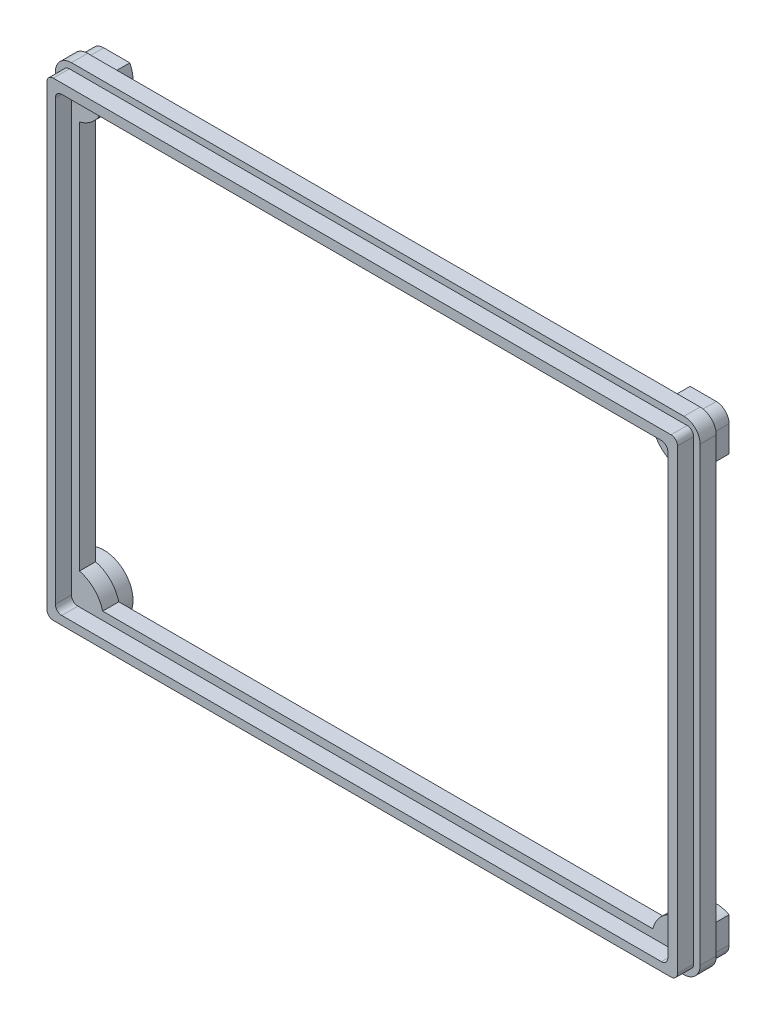
from build123d import *

# Parameters (mm, degrees)
RESSALTO_EXTRUS_O1_DEPTH   = 10
RESSALTO_EXTRUS_O1_2_DEPTH = 10
RESSALTO_EXTRUS_O1_3_DEPTH = 10
RESSALTO_EXTRUS_O1_4_DEPTH = 10
RESSALTO_EXTRUS_O2_DEPTH   = 5
RESSALTO_EXTRUS_O2_2_DEPTH = 5
RESSALTO_EXTRUS_O2_3_DEPTH = 5
RESSALTO_EXTRUS_O2_4_DEPTH = 5
ESBO_O6_W                  = 8.660254038
ESBO_O6_H                  = 1
ESBO_O6_W_2                = 1
ESBO_O6_H_2                = 8.660254038
ESBO_O6_H_3                = 8.655255985
CORTE_EXTRUS_O2_DEPTH      = 5
CORTE_EXTRUS_O10_START     = -5
CORTE_EXTRUS_O10_DEPTH     = 5
CORTE_EXTRUS_O11_DEPTH     = 5
CORTE_EXTRUS_O12_START     = -5
CORTE_EXTRUS_O12_DEPTH     = 5
CORTE_EXTRUS_O15_DEPTH     = 5
CORTE_EXTRUS_O23_DEPTH     = 5
CORTE_EXTRUS_O24_DEPTH     = 5
ESBO_O15_W                 = 195.604606203
ESBO_O15_H                 = 145.68333658
RESSALTO_EXTRUS_O3_DEPTH   = 5
ESBO_O16_W                 = 190
ESBO_O16_H                 = 140
CORTE_EXTRUS_O25_DEPTH     = 5
FILETE1_R                  = 2
FILETE2_R                  = 2
FILETE3_R                  = 2
FILETE4_R                  = 2
FILETE5_R                  = 2
FILETE6_R                  = 2
FILETE7_R                  = 2
FILETE8_R                  = 2


with BuildPart() as part:
    # Esboço4 → Ressalto-extrusão1 (new body)
    with BuildSketch(Plane.XY):
        with BuildLine():
            Line((-94.587795422, 19.928649923), (-94.587795422, 28.588903961))
            ThreePointArc((-94.587795422, 28.588903961), (-93.123329328, 32.124437867), (-89.587795422, 33.588903961))
            Line((-89.587795422, 33.588903961), (-80.927541384, 33.588903961))
            ThreePointArc((-80.927541384, 33.588903961), (-82.51672761, 21.517836149), (-94.587795422, 19.928649923))
        make_face()
    extrude(amount=-RESSALTO_EXTRUS_O1_DEPTH)


with BuildPart() as body_2:
    # Esboço4 → Ressalto-extrus_o1 2 (new body)
    with BuildSketch(Plane.XY):
        with BuildLine():
            Line((91.75195054, 33.588903961), (100.412204578, 33.588903961))
            ThreePointArc((100.412204578, 33.588903961), (103.947738484, 32.124437867), (105.412204578, 28.588903961))
            Line((105.412204578, 28.588903961), (105.412204578, 19.928649923))
            ThreePointArc((105.412204578, 19.928649923), (93.341136766, 21.517836149), (91.75195054, 33.588903961))
        make_face()
    extrude(amount=-RESSALTO_EXTRUS_O1_2_DEPTH)


with BuildPart() as body_3:
    # Esboço4 → Ressalto-extrus_o1 3 (new body)
    with BuildSketch(Plane.XY):
        with BuildLine():
            Line((105.412204578, -102.750842001), (105.412204578, -111.411096039))
            ThreePointArc((105.412204578, -111.411096039), (103.947738484, -114.946629945), (100.412204578, -116.411096039))
            Line((100.412204578, -116.411096039), (91.75195054, -116.411096039))
            ThreePointArc((91.75195054, -116.411096039), (93.341136766, -104.340028227), (105.412204578, -102.750842001))
        make_face()
    extrude(amount=-RESSALTO_EXTRUS_O1_3_DEPTH)


with BuildPart() as body_4:
    # Esboço4 → Ressalto-extrus_o1 4 (new body)
    with BuildSketch(Plane.XY):
        with BuildLine():
            Line((-80.927541384, -116.411096039), (-89.587795422, -116.411096039))
            ThreePointArc((-89.587795422, -116.411096039), (-93.123329328, -114.946629945), (-94.587795422, -111.411096039))
            Line((-94.587795422, -111.411096039), (-94.587795422, -102.750842001))
            ThreePointArc((-94.587795422, -102.750842001), (-82.51672761, -104.340028227), (-80.927541384, -116.411096039))
        make_face()
    extrude(amount=-RESSALTO_EXTRUS_O1_4_DEPTH)


with BuildPart() as body_5:
    # Esboço5 → Ressalto-extrusão2 (new body)
    with BuildSketch(Plane.XY):
        with BuildLine():
            Line((-87.087795422, 18.906445595), (-87.087795422, -101.728637674))
            ThreePointArc((-87.087795422, -101.728637674), (-90.938249206, -101.502701892), (-94.587795422, -102.750842001))
            Line((-94.587795422, -102.750842001), (-94.587795422, 19.928649923))
            ThreePointArc((-94.587795422, 19.928649923), (-90.938249206, 18.680509814), (-87.087795422, 18.906445595))
        make_face()
    extrude(amount=-RESSALTO_EXTRUS_O2_DEPTH)


with BuildPart() as body_6:
    # Esboço5 → Ressalto-extrus_o2 2 (new body)
    with BuildSketch(Plane.XY):
        with BuildLine():
            Line((-80.927541384, -116.411096039), (91.75195054, -116.411096039))
            ThreePointArc((91.75195054, -116.411096039), (90.50381043, -112.761549823), (90.729746212, -108.911096039))
            Line((90.729746212, -108.911096039), (-79.905337057, -108.911096039))
            ThreePointArc((-79.905337057, -108.911096039), (-79.679401275, -112.761549823), (-80.927541384, -116.411096039))
        make_face()
    extrude(amount=-RESSALTO_EXTRUS_O2_2_DEPTH)


with BuildPart() as body_7:
    # Esboço5 → Ressalto-extrus_o2 3 (new body)
    with BuildSketch(Plane.XY):
        with BuildLine():
            Line((97.912204578, 18.906445595), (97.912204578, -101.728637674))
            ThreePointArc((97.912204578, -101.728637674), (101.762658361, -101.502701892), (105.412204578, -102.750842001))
            Line((105.412204578, -102.750842001), (105.412204578, 19.928649923))
            ThreePointArc((105.412204578, 19.928649923), (101.762658361, 18.680509814), (97.912204578, 18.906445595))
        make_face()
    extrude(amount=-RESSALTO_EXTRUS_O2_3_DEPTH)


with BuildPart() as body_8:
    # Esboço5 → Ressalto-extrus_o2 4 (new body)
    with BuildSketch(Plane.XY):
        with BuildLine():
            Line((90.729746212, 26.088903961), (-79.905337057, 26.088903961))
            ThreePointArc((-79.905337057, 26.088903961), (-79.679401275, 29.939357745), (-80.927541384, 33.588903961))
            Line((-80.927541384, 33.588903961), (91.75195054, 33.588903961))
            ThreePointArc((91.75195054, 33.588903961), (90.50381043, 29.939357745), (90.729746212, 26.088903961))
        make_face()
    extrude(amount=-RESSALTO_EXTRUS_O2_4_DEPTH)


with BuildPart() as corte_extrus_o2_tool:
    # Esboço6 → Corte-extrusão2 (new body)
    with BuildSketch(Plane(origin=(0, 0, -10), x_dir=(-1, 0, 0), z_dir=(0, 0, -1))):
        with Locations((-96.082077559, 33.088903961)):
            Rectangle(ESBO_O6_W, ESBO_O6_H)
        with Locations((-104.912204578, 24.258776942)):
            Rectangle(ESBO_O6_W_2, ESBO_O6_H_2)
        with Locations((85.257668403, 33.088903961)):
            Rectangle(ESBO_O6_W, ESBO_O6_H)
        with Locations((94.087795422, 24.258776942)):
            Rectangle(ESBO_O6_W_2, ESBO_O6_H_2)
        with Locations((94.087795422, -107.078469994)):
            Rectangle(ESBO_O6_W_2, ESBO_O6_H_3)
        with Locations((85.257668403, -115.911096039)):
            Rectangle(ESBO_O6_W, ESBO_O6_H)
        with Locations((-96.082077559, -115.911096039)):
            Rectangle(ESBO_O6_W, ESBO_O6_H)
        with Locations((-104.912204578, -107.078469994)):
            Rectangle(ESBO_O6_W_2, ESBO_O6_H_3)
    extrude(amount=-CORTE_EXTRUS_O2_DEPTH)


with BuildPart() as part_1:
    add(part.part)

    # Corte-extrusão2: cut by corte_extrus_o2_tool
    add(corte_extrus_o2_tool.part, mode=Mode.SUBTRACT)


with BuildPart() as body_2_1:
    add(body_2.part)

    # Corte-extrusão2: cut by corte_extrus_o2_tool
    add(corte_extrus_o2_tool.part, mode=Mode.SUBTRACT)


with BuildPart() as body_3_1:
    add(body_3.part)

    # Corte-extrusão2: cut by corte_extrus_o2_tool
    add(corte_extrus_o2_tool.part, mode=Mode.SUBTRACT)


with BuildPart() as body_4_1:
    add(body_4.part)

    # Corte-extrusão2: cut by corte_extrus_o2_tool
    add(corte_extrus_o2_tool.part, mode=Mode.SUBTRACT)


with BuildPart() as corte_extrus_o10_tool:
    # Esboço7 → Corte-extrusão10 (new body)
    with BuildSketch(Plane(origin=(0, 0, -10), x_dir=(-1, 0, 0), z_dir=(0, 0, -1)).offset(CORTE_EXTRUS_O10_START)):
        with BuildLine():
            Line((-104.412204578, 20.478816645), (-104.412204578, 19.928649923))
            Line((-104.412204578, 19.928649923), (-105.412204578, 19.928649923))
            ThreePointArc((-105.412204578, 19.928649923), (-93.341136766, 21.517836149), (-91.75195054, 33.588903961))
            Line((-91.75195054, 33.588903961), (-91.75195054, 32.588903961))
            Line((-91.75195054, 32.588903961), (-92.302117262, 32.588903961))
            ThreePointArc((-92.302117262, 32.588903961), (-93.947771981, 22.124471364), (-104.412204578, 20.478816645))
        make_face()
        with BuildLine():
            Line((80.927541384, 33.588903961), (80.927541384, 32.588903961))
            Line((80.927541384, 32.588903961), (81.478060811, 32.588903961))
            ThreePointArc((81.478060811, 32.588903961), (83.127936997, 22.129045536), (93.587795422, 20.47916935))
            Line((93.587795422, 20.47916935), (93.587795422, 19.928649923))
            Line((93.587795422, 19.928649923), (94.587795422, 19.928649923))
            ThreePointArc((94.587795422, 19.928649923), (82.51672761, 21.517836149), (80.927541384, 33.588903961))
        make_face()
        with BuildLine():
            Line((94.587795422, -102.750842001), (93.587795422, -102.750842001))
            Line((93.587795422, -102.750842001), (93.587795422, -103.300929913))
            ThreePointArc((93.587795422, -103.300929913), (83.122340911, -104.945641528), (81.477629296, -115.411096039))
            Line((81.477629296, -115.411096039), (80.927541384, -115.411096039))
            Line((80.927541384, -115.411096039), (80.927541384, -116.411096039))
            ThreePointArc((80.927541384, -116.411096039), (82.51672761, -104.340028227), (94.587795422, -102.750842001))
        make_face()
        with BuildLine():
            Line((-105.412204578, -102.750842001), (-104.412204578, -102.750842001))
            Line((-104.412204578, -102.750842001), (-104.412204578, -103.300967216))
            ThreePointArc((-104.412204578, -103.300967216), (-93.947233755, -104.946125217), (-92.302075754, -115.411096039))
            Line((-92.302075754, -115.411096039), (-91.75195054, -115.411096039))
            Line((-91.75195054, -115.411096039), (-91.75195054, -116.411096039))
            ThreePointArc((-91.75195054, -116.411096039), (-93.341136766, -104.340028227), (-105.412204578, -102.750842001))
        make_face()
    extrude(amount=CORTE_EXTRUS_O10_DEPTH)


with BuildPart() as part_2:
    add(part_1.part)

    # Corte-extrusão10: cut by corte_extrus_o10_tool
    add(corte_extrus_o10_tool.part, mode=Mode.SUBTRACT)

    # Esboço10 → Corte-extrusão12 (cut)
    with BuildSketch(Plane(origin=(0, 0, -10), x_dir=(-1, 0, 0), z_dir=(0, 0, -1)).offset(CORTE_EXTRUS_O12_START)):
        with BuildLine():
            Line((89.587795422, 33.588903961), (89.587795422, 32.588903961))
            ThreePointArc((89.587795422, 32.588903961), (92.416222547, 31.417331086), (93.587795422, 28.588903961))
            Line((93.587795422, 28.588903961), (94.587795422, 28.588903961))
            ThreePointArc((94.587795422, 28.588903961), (93.123329328, 32.124437867), (89.587795422, 33.588903961))
        make_face()
    extrude(amount=CORTE_EXTRUS_O12_DEPTH, mode=Mode.SUBTRACT)



with BuildPart() as body_2_2:
    add(body_2_1.part)

    # Corte-extrusão10: cut by corte_extrus_o10_tool
    add(corte_extrus_o10_tool.part, mode=Mode.SUBTRACT)

    # Esboço9 → Corte-extrusão11 (cut)
    with BuildSketch(Plane(origin=(0, 0, -10), x_dir=(-1, 0, 0), z_dir=(0, 0, -1))):
        with BuildLine():
            Line((-104.412204578, 28.588903961), (-105.412204578, 28.588903961))
            ThreePointArc((-105.412204578, 28.588903961), (-103.947738484, 32.124437867), (-100.412204578, 33.588903961))
            Line((-100.412204578, 33.588903961), (-100.412204578, 32.588903961))
            ThreePointArc((-100.412204578, 32.588903961), (-103.240631702, 31.417331086), (-104.412204578, 28.588903961))
        make_face()
    extrude(amount=-CORTE_EXTRUS_O11_DEPTH, mode=Mode.SUBTRACT)


with BuildPart() as body_3_2:
    add(body_3_1.part)

    # Corte-extrusão10: cut by corte_extrus_o10_tool
    add(corte_extrus_o10_tool.part, mode=Mode.SUBTRACT)

    # Esboço12 → Corte-extrusão15 (cut)
    with BuildSketch(Plane(origin=(0, 0, -10), x_dir=(-1, 0, 0), z_dir=(0, 0, -1))):
        with BuildLine():
            Line((-105.412204578, -111.406097986), (-104.412204578, -111.406097986))
            ThreePointArc((-104.412204578, -111.406097986), (-103.241666833, -114.237024137), (-100.412204578, -115.411096039))
            Line((-100.412204578, -115.411096039), (-100.412204578, -116.411096039))
            ThreePointArc((-100.412204578, -116.411096039), (-103.949505916, -114.944862489), (-105.412204578, -111.406097986))
        make_face()
    extrude(amount=-CORTE_EXTRUS_O15_DEPTH, mode=Mode.SUBTRACT)


with BuildPart() as body_4_2:
    add(body_4_1.part)

    # Corte-extrusão10: cut by corte_extrus_o10_tool
    add(corte_extrus_o10_tool.part, mode=Mode.SUBTRACT)

    # Esboço13 → Corte-extrusão23 (cut)
    with BuildSketch(Plane(origin=(0, 0, -10), x_dir=(-1, 0, 0), z_dir=(0, 0, -1))):
        with BuildLine():
            Line((89.587795422, -115.91873065), (89.587795422, -116.411096039))
            ThreePointArc((89.587795422, -116.411096039), (93.123329328, -114.946629945), (94.587795422, -111.411096039))
            Line((94.587795422, -111.411096039), (94.087795422, -111.408597013))
            ThreePointArc((94.087795422, -111.408597013), (92.771874683, -114.595644347), (89.587795422, -115.91873065))
        make_face()
    extrude(amount=-CORTE_EXTRUS_O23_DEPTH, mode=Mode.SUBTRACT)

    # Esboço14 → Corte-extrusão24 (cut)
    with BuildSketch(Plane(origin=(0, 0, -10), x_dir=(-1, 0, 0), z_dir=(0, 0, -1))):
        with BuildLine():
            Line((89.587795422, -115.411096039), (89.587795422, -116.007236172))
            Line((89.587795422, -116.007236172), (93.587795422, -115.579473673))
            Line((93.587795422, -115.579473673), (94.418359323, -115.579473673))
            Line((94.418359323, -115.579473673), (94.647359239, -111.35922068))
            Line((94.647359239, -111.35922068), (93.587795422, -111.406097986))
            ThreePointArc((93.587795422, -111.406097986), (92.417257678, -114.237024137), (89.587795422, -115.411096039))
        make_face()
    extrude(amount=-CORTE_EXTRUS_O24_DEPTH, mode=Mode.SUBTRACT)


with BuildPart() as part_3:
    add(part_2.part)

    add(body_2_2.part)  # Ressalto-extrusão3 merges body 2

    add(body_3_2.part)  # Ressalto-extrusão3 merges body 3

    add(body_4_2.part)  # Ressalto-extrusão3 merges body 4

    add(body_5.part)  # Ressalto-extrusão3 merges body 5

    add(body_6.part)  # Ressalto-extrusão3 merges body 6

    add(body_7.part)  # Ressalto-extrusão3 merges body 7

    add(body_8.part)  # Ressalto-extrusão3 merges body 8
    # Esboço15 → Ressalto-extrusão3 (add)
    with BuildSketch(Plane.XY):
        with Locations((5.597386114, -41.227756112)):
            Rectangle(ESBO_O15_W, ESBO_O15_H)
    extrude(amount=RESSALTO_EXTRUS_O3_DEPTH)

    # Esboço16 → Corte-extrusão25 (cut)
    with BuildSketch(Plane.XY.offset(5)):
        with Locations((5.412204578, -41.411096039)):
            Rectangle(ESBO_O16_W, ESBO_O16_H)
    extrude(amount=-CORTE_EXTRUS_O25_DEPTH, mode=Mode.SUBTRACT)

    # Filete1
    filete1_edges = [part_3.edges().sort_by_distance(p)[0] for p in [
        (103.399689215, -114.069424402, 2.5),
    ]]
    fillet(filete1_edges, radius=FILETE1_R)

    # Filete2
    filete2_edges = [part_3.edges().sort_by_distance(p)[0] for p in [
        (103.399689215, 31.613912178, 2.5),
    ]]
    fillet(filete2_edges, radius=FILETE2_R)

    # Filete3
    filete3_edges = [part_3.edges().sort_by_distance(p)[0] for p in [
        (100.412204578, 28.588903961, 2.5),
    ]]
    fillet(filete3_edges, radius=FILETE3_R)

    # Filete4
    filete4_edges = [part_3.edges().sort_by_distance(p)[0] for p in [
        (100.412204578, -111.411096039, 2.5),
    ]]
    fillet(filete4_edges, radius=FILETE4_R)

    # Filete5
    filete5_edges = [part_3.edges().sort_by_distance(p)[0] for p in [
        (-89.587795422, 28.588903961, 2.5),
    ]]
    fillet(filete5_edges, radius=FILETE5_R)

    # Filete6
    filete6_edges = [part_3.edges().sort_by_distance(p)[0] for p in [
        (-92.204916988, 31.613912178, 2.5),
    ]]
    fillet(filete6_edges, radius=FILETE6_R)

    # Filete7
    filete7_edges = [part_3.edges().sort_by_distance(p)[0] for p in [
        (-92.204916988, -114.069424402, 2.5),
    ]]
    fillet(filete7_edges, radius=FILETE7_R)

    # Filete8
    filete8_edges = [part_3.edges().sort_by_distance(p)[0] for p in [
        (-89.587795422, -111.411096039, 2.5),
    ]]
    fillet(filete8_edges, radius=FILETE8_R)


solid = part_3.part
